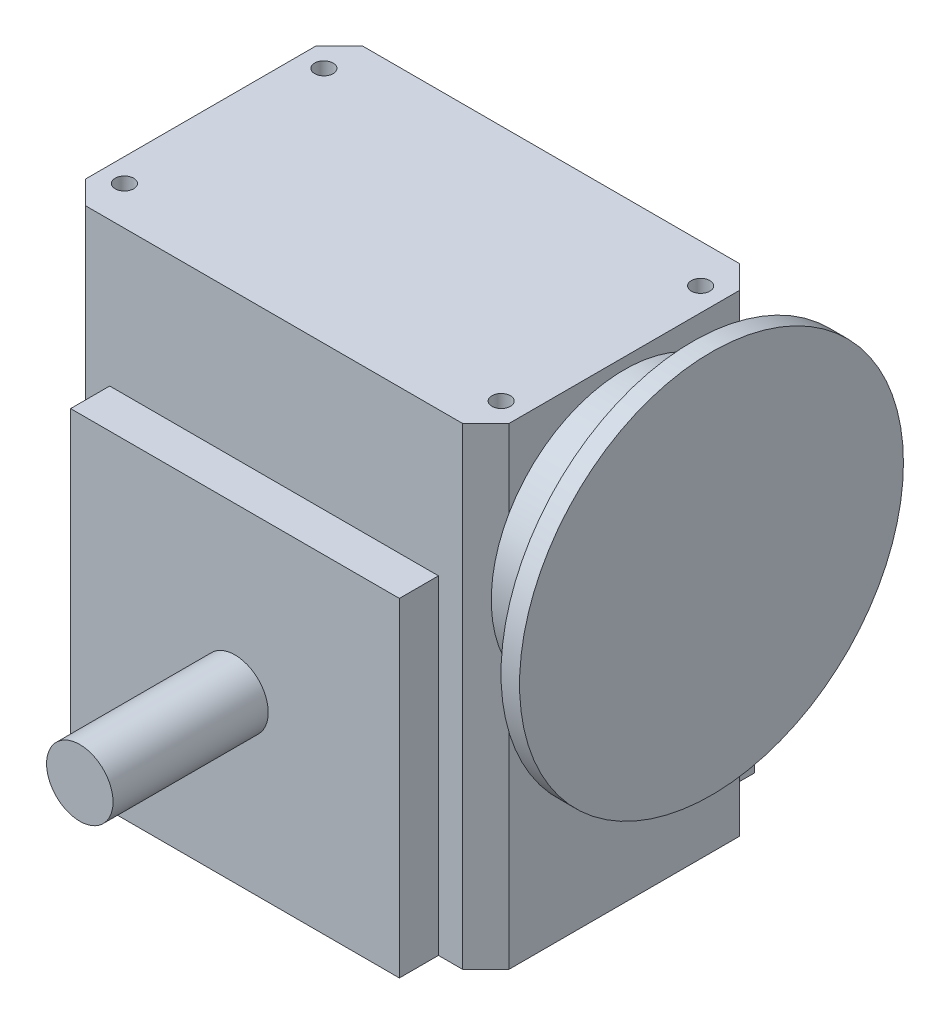
from build123d import *

# Parameters (mm, degrees)
SKETCH1_W                                 = 181.991
SKETCH1_H                                 = 118.999
BOSS_EXTRUDE1_DEPTH                       = 203.2
SKETCH2_W                                 = 141.3002
SKETCH2_H                                 = 141.3002
BOSS_EXTRUDE2_DEPTH                       = 16.8021
SKETCH3_R                                 = 14.2875
BOSS_EXTRUDE3_DEPTH                       = 66.7004
TAP_DRILL_FOR_3_8_16_TAP1_D               = 7.9375
TAP_DRILL_FOR_3_8_16_TAP1_DEPTH           = 12.7
TAP_DRILL_FOR_3_8_16_TAP1_TIP             = 2.384665582
TAP_DRILL_FOR_3_8_16_TAP1_ON_FACE_2_D     = 7.9375
TAP_DRILL_FOR_3_8_16_TAP1_ON_FACE_2_DEPTH = 12.7
TAP_DRILL_FOR_3_8_16_TAP1_ON_FACE_2_TIP   = 2.384665582
CHAMFER1_SIZE                             = 10.033
SKETCH7_R                                 = 57.15
BOSS_EXTRUDE4_DEPTH                       = 37.5031
SKETCH8_R                                 = 82.4992
BOSS_EXTRUDE5_DEPTH                       = 7.9756


with BuildPart() as part:
    # Sketch1 → Boss-Extrude1 (new body)
    with BuildSketch(Plane(origin=(0, 0, 0), x_dir=(1, 0, 0), z_dir=(0, 1, 0))):
        Rectangle(SKETCH1_W, SKETCH1_H)
    extrude(amount=BOSS_EXTRUDE1_DEPTH)

    # Sketch2 → Boss-Extrude2 (add)
    with BuildSketch(Plane.XY.offset(59.4995)):
        with Locations((0, 70.6501)):
            Rectangle(SKETCH2_W, SKETCH2_H)
    boss_extrude2 = extrude(amount=BOSS_EXTRUDE2_DEPTH)

    # Sketch3 → Boss-Extrude3 (add)
    with BuildSketch(Plane.XY.offset(76.3016)):
        with Locations(Location((0, 70.6501, 0), (0, 0, 180))):
            Circle(SKETCH3_R)
    extrude(amount=BOSS_EXTRUDE3_DEPTH)

    # Tap Drill for 3/8-16 Tap1
    with Locations(Plane(origin=(-80.9625, 0, -42.8625), x_dir=(0, 0, -1), z_dir=(0, -1, 0))):
        with Locations((0, 0), (-85.725, 0), (-85.725, 161.925), (0, 161.925)):
            Hole(TAP_DRILL_FOR_3_8_16_TAP1_D / 2, depth=TAP_DRILL_FOR_3_8_16_TAP1_DEPTH)
            with Locations((0, 0, -(TAP_DRILL_FOR_3_8_16_TAP1_DEPTH + TAP_DRILL_FOR_3_8_16_TAP1_TIP / 2))):  # 118° drill point
                Cone(0, TAP_DRILL_FOR_3_8_16_TAP1_D / 2, TAP_DRILL_FOR_3_8_16_TAP1_TIP, mode=Mode.SUBTRACT)

    # Tap Drill for 3/8-16 Tap1 on face 2
    with Locations(Plane(origin=(80.9625, 203.2, -42.8625), x_dir=(0, 0, 1), z_dir=(0, 1, 0))):
        with Locations((0, 0), (85.725, 0), (85.725, -161.925), (0, -161.925)):
            Hole(TAP_DRILL_FOR_3_8_16_TAP1_ON_FACE_2_D / 2, depth=TAP_DRILL_FOR_3_8_16_TAP1_ON_FACE_2_DEPTH)
            with Locations((0, 0, -(TAP_DRILL_FOR_3_8_16_TAP1_ON_FACE_2_DEPTH + TAP_DRILL_FOR_3_8_16_TAP1_ON_FACE_2_TIP / 2))):  # 118° drill point
                Cone(0, TAP_DRILL_FOR_3_8_16_TAP1_ON_FACE_2_D / 2, TAP_DRILL_FOR_3_8_16_TAP1_ON_FACE_2_TIP, mode=Mode.SUBTRACT)

    # Chamfer1
    chamfer1_edges = [part.edges().sort_by_distance(p)[0] for p in [
        (90.9955, 101.6, 59.4995),
        (-90.9955, 101.6, 59.4995),
        (-90.9955, 101.6, -59.4995),
        (90.9955, 101.6, -59.4995),
    ]]
    chamfer(chamfer1_edges, length=CHAMFER1_SIZE)

    # Mirror1: Boss-Extrude2 across plane
    add(boss_extrude2.mirror(Plane.XY))

    # Sketch7 → Boss-Extrude4 (add)
    with BuildSketch(Plane(origin=(90.9955, 0, 0), x_dir=(0, 0, -1), z_dir=(1, 0, 0))):
        with Locations(Location((0, 141.3002, 0), (0, 0, 149.946203095))):
            Circle(SKETCH7_R)
    extrude(amount=BOSS_EXTRUDE4_DEPTH)

    # Sketch8 → Boss-Extrude5 (add)
    with BuildSketch(Plane(origin=(128.4986, 0, 0), x_dir=(0, 0, -1), z_dir=(1, 0, 0))):
        with Locations((0, 141.3002)):
            Circle(SKETCH8_R)
    extrude(amount=-BOSS_EXTRUDE5_DEPTH)


solid = part.part
